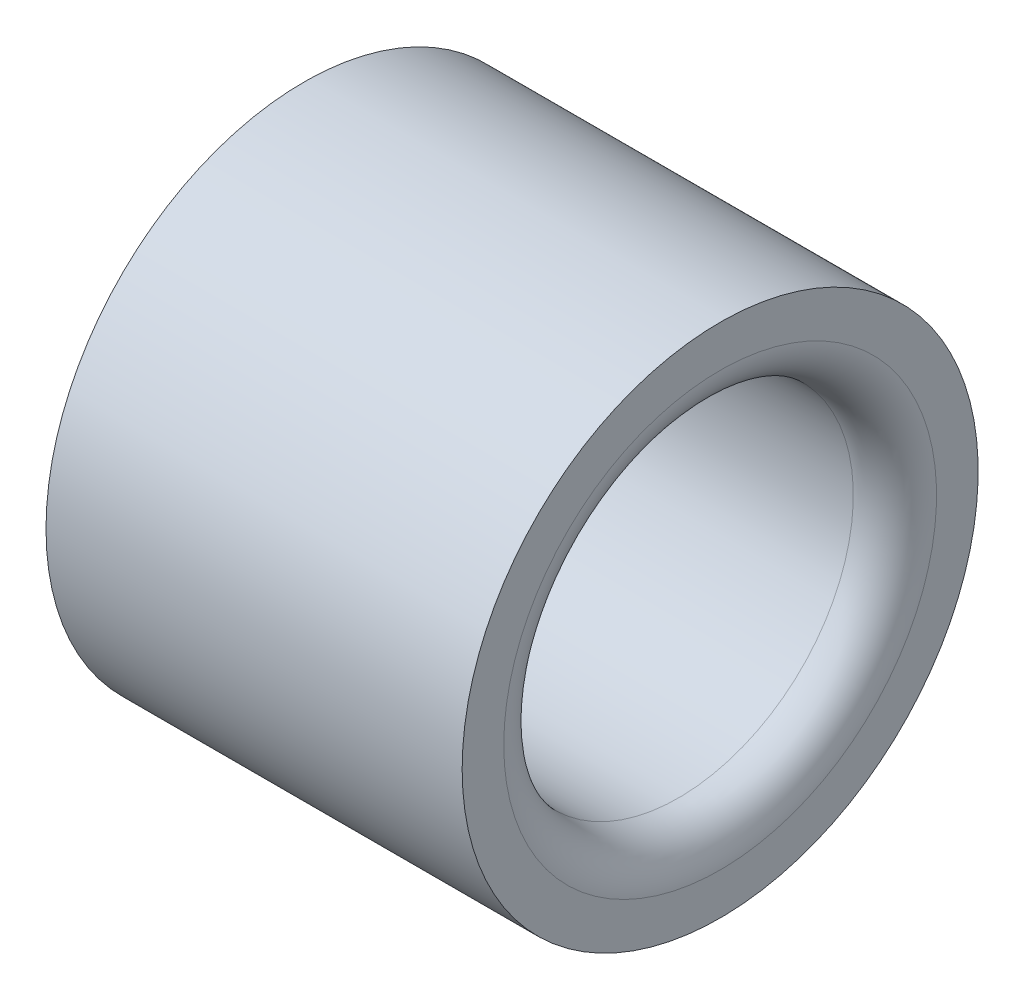
from build123d import *

# Parameters (mm, degrees)
FILLET1_R = 1


with BuildPart() as part:
    # Sketch1 → Revolve1 (revolve)
    with BuildSketch(Plane.XY, mode=Mode.PRIVATE) as revolve1_sk:
        Polygon((0, 2.7), (1.423611111, 2.7), (1.423611111, 4.2), (10, 4.2), (10, 6.2), (0, 6.2), align=None)
    revolve(revolve1_sk.sketch.rotate(Axis((0, 0, 0), (1, 0, 0)), 90), axis=Axis((0, 0, 0), (1, 0, 0)))

    # Fillet1
    fillet1_edges = [part.edges().sort_by_distance(p)[0] for p in [
        (10, 0, -4.2),
    ]]
    fillet(fillet1_edges, radius=FILLET1_R)


solid = part.part
